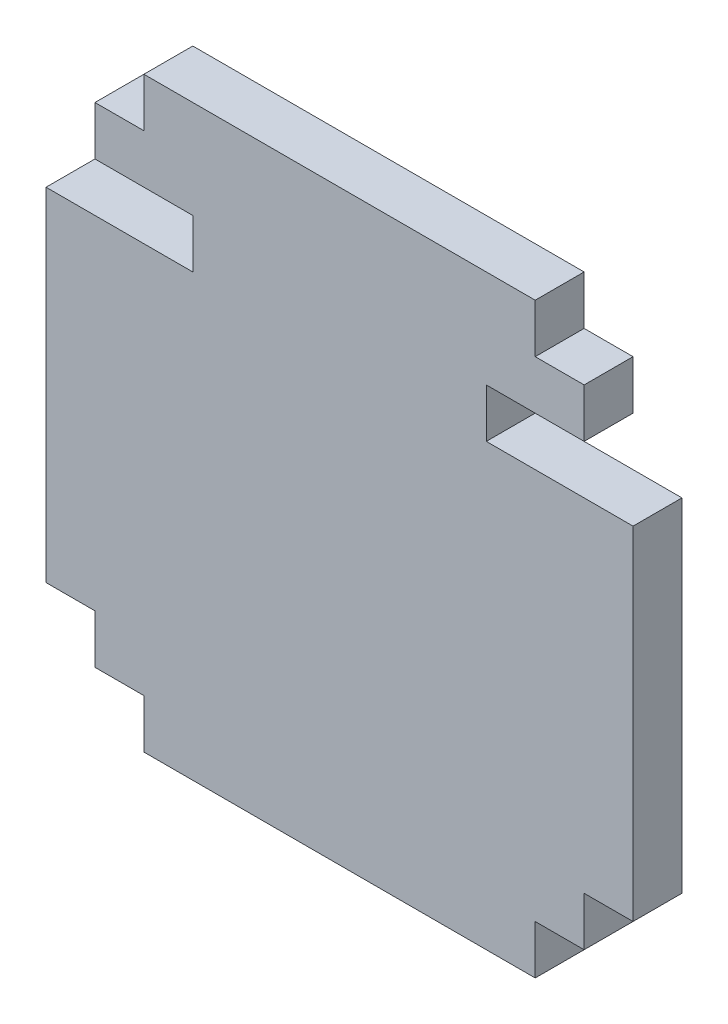
from build123d import *

# Parameters (mm, degrees)
BOSS_EXTRUDE1_DEPTH = 6.35
SKETCH3_W           = 19.05
SKETCH3_H           = 6.35
CUT_EXTRUDE1_DEPTH  = 83.611035128


with BuildPart() as part:
    # Sketch1 → Boss-Extrude1 (new body)
    with BuildSketch(Plane.XY):
        Polygon((-25.4, -3.175), (25.4, -3.175), (25.4, 3.175), (31.75, 3.175), (31.75, 9.525), (38.1, 9.525), (38.1, 60.325), (31.75, 60.325), (31.75, 66.675), (25.4, 66.675), (25.4, 73.025), (-25.4, 73.025), (-25.4, 66.675), (-31.75, 66.675), (-31.75, 60.325), (-38.1, 60.325), (-38.1, 9.525), (-31.75, 9.525), (-31.75, 3.175), (-25.4, 3.175), align=None)
    extrude(amount=BOSS_EXTRUDE1_DEPTH)

    # Sketch3 → Cut-Extrude1 (cut, through all)
    with BuildSketch(Plane.XY.offset(6.35)):
        with Locations((28.575, 57.15)):
            Rectangle(SKETCH3_W, SKETCH3_H)
        with Locations((-28.575, 57.15)):
            Rectangle(SKETCH3_W, SKETCH3_H)
    extrude(amount=-CUT_EXTRUDE1_DEPTH, mode=Mode.SUBTRACT)


solid = part.part
